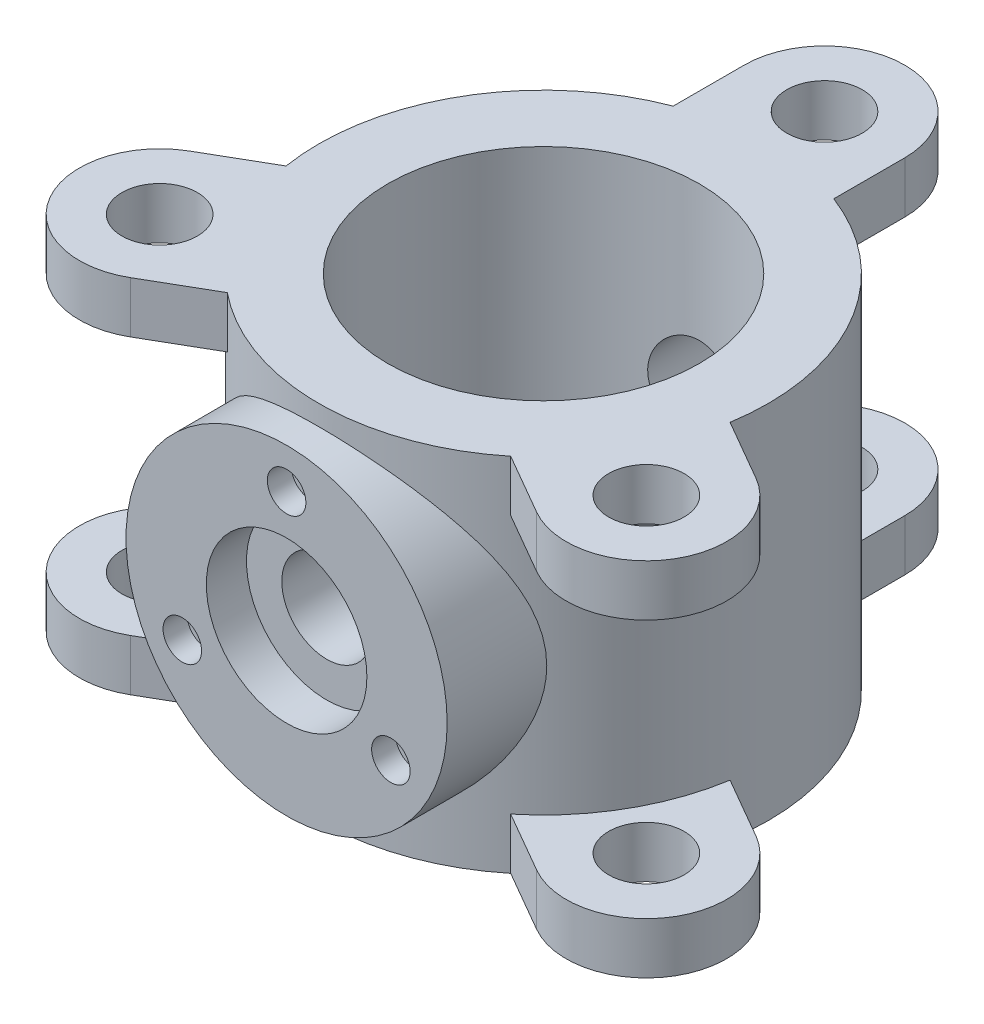
from build123d import *

# Parameters (mm, degrees)
SKETCH1_R                = 140
SKETCH1_R_2              = 97
BOSS_EXTRUDE1_DEPTH      = 225
SKETCH2_R                = 23.5
BOSS_EXTRUDE2_DEPTH      = 32
CIRPATTERN1_COUNT        = 3
MIRROR1_COPY_1_SKETCH_R  = 23.5
MIRROR1_COPY_1_DEPTH     = 32
MIRROR1_COPY_2_SKETCH_R  = 23.5
MIRROR1_COPY_2_DEPTH     = 32
BOSS_EXTRUDE3_REACH      = 491.361
BOSS_EXTRUDE3_END_RADIUS = 140
SKETCH4_R                = 100
SKETCH5_R                = 50
CUT_EXTRUDE1_DEPTH       = 25
SKETCH6_R                = 28
CUT_EXTRUDE2_DEPTH       = 470.945948606
SKETCH7_R                = 12
CUT_EXTRUDE3_DEPTH       = 15
CIRPATTERN2_COUNT        = 3


with BuildPart() as part:
    # Sketch1 → Boss-Extrude1 (new body)
    with BuildSketch(Plane(origin=(0, 0, 0), x_dir=(1, 0, 0), z_dir=(0, 1, 0))):
        with Locations(Location((0, 0, 0), (0, 0, 270))):
            Circle(SKETCH1_R)
        with Locations(Location((0, 0, 0), (0, 0, 270))):
            Circle(SKETCH1_R_2, mode=Mode.SUBTRACT)
    extrude(amount=BOSS_EXTRUDE1_DEPTH)

    # Sketch2 → Boss-Extrude2 (add)
    with BuildSketch(Plane(origin=(0, 225, 0), x_dir=(1, 0, 0), z_dir=(0, 1, 0))):
        with BuildLine():
            Line((-50, 114.63072423), (50, 114.63072423))
            Line((50, 114.63072423), (50, 175))
            ThreePointArc((50, 175), (0, 225), (-50, 175))
            Line((-50, 175), (-50, 114.63072423))
        make_face()
        with Locations(Location((0, 175, 0), (0, 0, 270))):
            Circle(SKETCH2_R, mode=Mode.SUBTRACT)
    boss_extrude2 = extrude(amount=-BOSS_EXTRUDE2_DEPTH)

    # CirPattern1: Boss-Extrude2 ×3 about axis
    cirpattern1_axis = Axis((0, 0, 0), (0, 1, 0))
    for i in range(1, CIRPATTERN1_COUNT):
        add(boss_extrude2.rotate(cirpattern1_axis, i * 360 / CIRPATTERN1_COUNT))

    # Mirror1: Boss-Extrude2 across plane
    add(boss_extrude2.mirror(Plane.ZX.offset(112.5)))

    # Mirror1 copy 1 sketch → Mirror1 copy 1 (add)
    with BuildSketch(Plane(origin=(0, 0, 0), x_dir=(-0.4999999999999998, 0, -0.8660254037844387), z_dir=(0, -1, 0))):
        with BuildLine():
            Line((-50, -114.63072423), (50, -114.63072423))
            Line((50, -114.63072423), (50, -175))
            ThreePointArc((50, -175), (0, -225), (-50, -175))
            Line((-50, -175), (-50, -114.63072423))
        make_face()
        with Locations((0, -175)):
            Circle(MIRROR1_COPY_1_SKETCH_R, mode=Mode.SUBTRACT)
    extrude(amount=-MIRROR1_COPY_1_DEPTH)

    # Mirror1 copy 2 sketch → Mirror1 copy 2 (add)
    with BuildSketch(Plane(origin=(0, 0, 0), x_dir=(-0.5000000000000004, 0, 0.8660254037844384), z_dir=(0, -1, 0))):
        with BuildLine():
            Line((-50, -114.63072423), (50, -114.63072423))
            Line((50, -114.63072423), (50, -175))
            ThreePointArc((50, -175), (0, -225), (-50, -175))
            Line((-50, -175), (-50, -114.63072423))
        make_face()
        with Locations((0, -175)):
            Circle(MIRROR1_COPY_2_SKETCH_R, mode=Mode.SUBTRACT)
    extrude(amount=-MIRROR1_COPY_2_DEPTH)

    # Boss-Extrude3: up to this cylinder (the profile starts outside it)
    boss_extrude3_end = Plane(origin=(0, 112.5, 0), z_dir=(0, -1, 0)) * Cylinder(BOSS_EXTRUDE3_END_RADIUS, 1263.722, mode=Mode.PRIVATE)
    # Sketch4 → Boss-Extrude3 (add, up to the surface)
    with BuildSketch(Plane.XY.offset(160), mode=Mode.PRIVATE) as boss_extrude3_sk1:
        with Locations((0, 112.5)):
            Circle(SKETCH4_R)
    boss_extrude3_tool1 = extrude(boss_extrude3_sk1.sketch, amount=-BOSS_EXTRUDE3_REACH, mode=Mode.PRIVATE) - boss_extrude3_end
    add(boss_extrude3_tool1.solids().sort_by_distance((0, 112.5, 160))[0])

    # Sketch5 → Cut-Extrude1 (cut)
    with BuildSketch(Plane.XY.offset(160)):
        with Locations((0, 112.5)):
            Circle(SKETCH5_R)
    extrude(amount=-CUT_EXTRUDE1_DEPTH, mode=Mode.SUBTRACT)

    # Sketch6 → Cut-Extrude2 (cut, through all)
    with BuildSketch(Plane.XY.offset(135)):
        with Locations((0, 112.5)):
            Circle(SKETCH6_R)
    extrude(amount=-CUT_EXTRUDE2_DEPTH, mode=Mode.SUBTRACT)

    # Sketch7 → Cut-Extrude3 (cut)
    with BuildSketch(Plane.XY.offset(160)):
        with Locations((0, 187.5)):
            Circle(SKETCH7_R)
    cut_extrude3 = extrude(amount=-CUT_EXTRUDE3_DEPTH, mode=Mode.SUBTRACT)

    # CirPattern2: Cut-Extrude3 ×3 about axis
    cirpattern2_axis = Axis((0, 112.5, 0), (0, 0, 1))
    for i in range(1, CIRPATTERN2_COUNT):
        add(cut_extrude3.rotate(cirpattern2_axis, i * 360 / CIRPATTERN2_COUNT), mode=Mode.SUBTRACT)


solid = part.part
